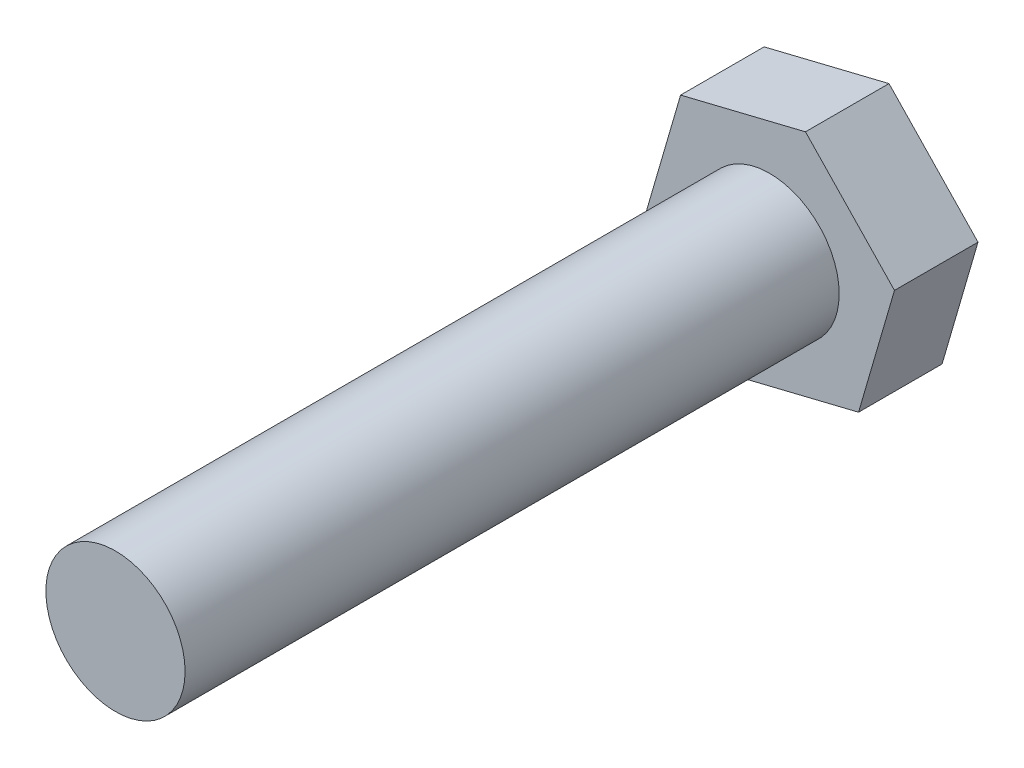
from build123d import *

# Parameters (mm, degrees)
BOSS_EXTRUDE1_DEPTH = 3
SKETCH2_R           = 2.5
BOSS_EXTRUDE2_DEPTH = 23.492


with BuildPart() as part:
    # Sketch1 → Boss-Extrude1 (new body)
    with BuildSketch(Plane.XY):
        Polygon((-3.195773982, 3.334720677), (-4.485839811, -1.100261115), (-1.29006583, -4.434981791), (3.195773982, -3.334720677), (4.485839811, 1.100261115), (1.29006583, 4.434981791), align=None)
    extrude(amount=BOSS_EXTRUDE1_DEPTH)

    # Sketch2 → Boss-Extrude2 (add)
    with BuildSketch(Plane.XY.offset(3)):
        Circle(SKETCH2_R)
    extrude(amount=BOSS_EXTRUDE2_DEPTH)


solid = part.part
